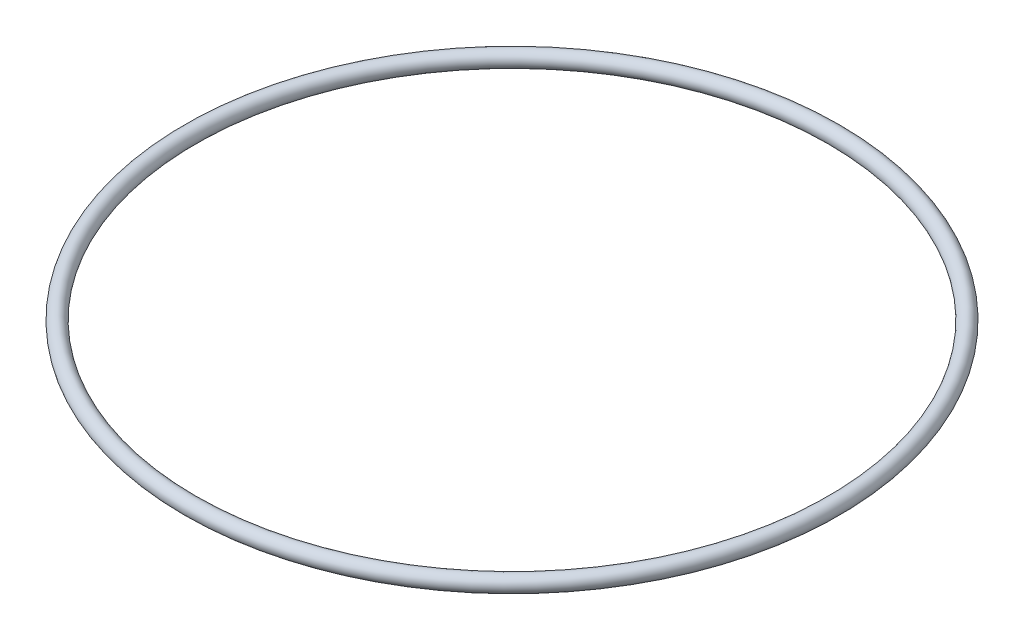
from build123d import *

# Parameters (mm, degrees)
SKETCH1_R = 1.5


with BuildPart() as part:
    # Sketch1 → Revolve1 (revolve)
    with BuildSketch(Plane(origin=(0, 0, 0), x_dir=(0, 0, -1), z_dir=(1, 0, 0))):
        with Locations((-61.5, 0)):
            Circle(SKETCH1_R)
    revolve(axis=Axis((0, 0, 0), (0, 1, 0)))


solid = part.part
